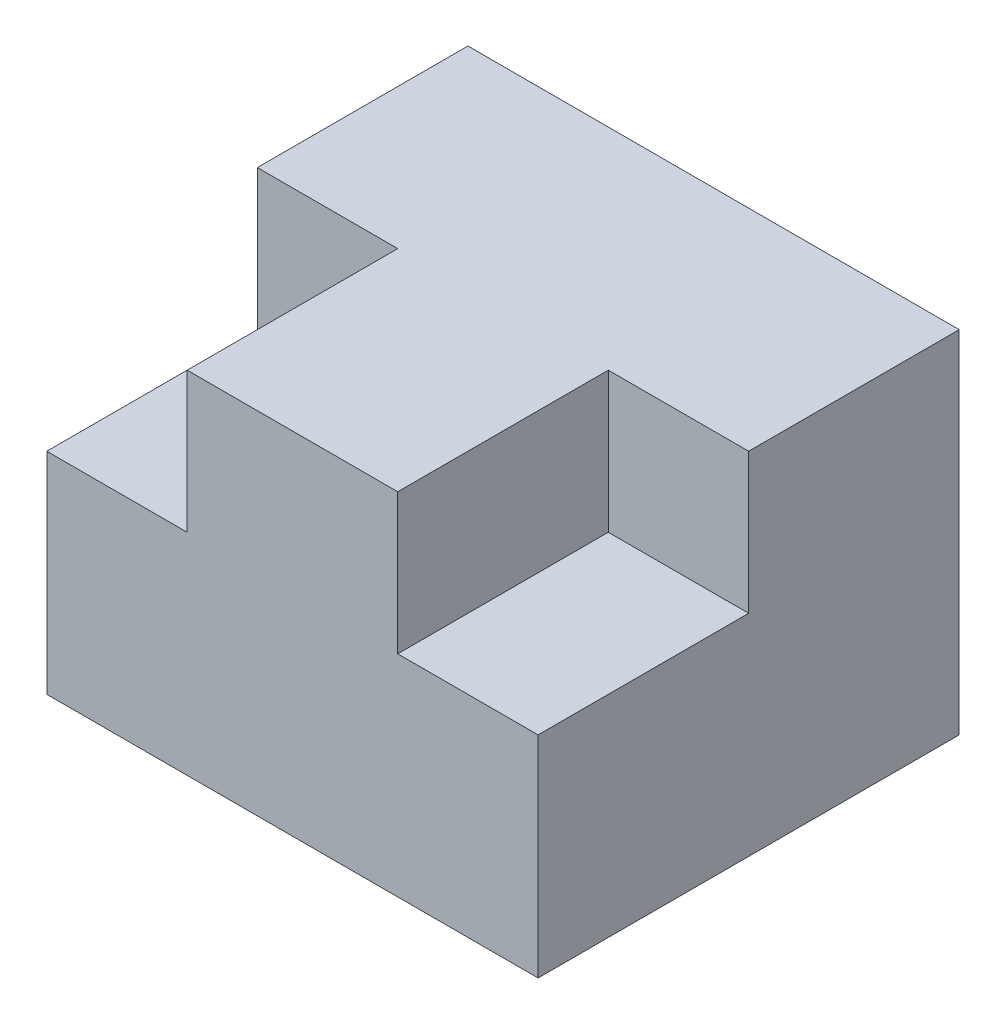
from build123d import *

# Parameters (mm, degrees)
BOSS_EXTRUDE1_DEPTH = 15
SKETCH2_W           = 35
SKETCH2_H           = 25
BOSS_EXTRUDE2_DEPTH = 15


with BuildPart() as part:
    # Sketch1 → Boss-Extrude1 (new body)
    with BuildSketch(Plane.XY):
        Polygon((-17.5, 0), (17.5, 0), (17.5, 15), (7.5, 15), (7.5, 25), (-7.5, 25), (-7.5, 15), (-17.5, 15), align=None)
    extrude(amount=BOSS_EXTRUDE1_DEPTH)

    # Sketch2 → Boss-Extrude2 (add)
    with BuildSketch(Plane(origin=(0, 0, 0), x_dir=(-1, 0, 0), z_dir=(0, 0, -1))):
        with Locations((0, 12.5)):
            Rectangle(SKETCH2_W, SKETCH2_H)
    extrude(amount=BOSS_EXTRUDE2_DEPTH)


solid = part.part
